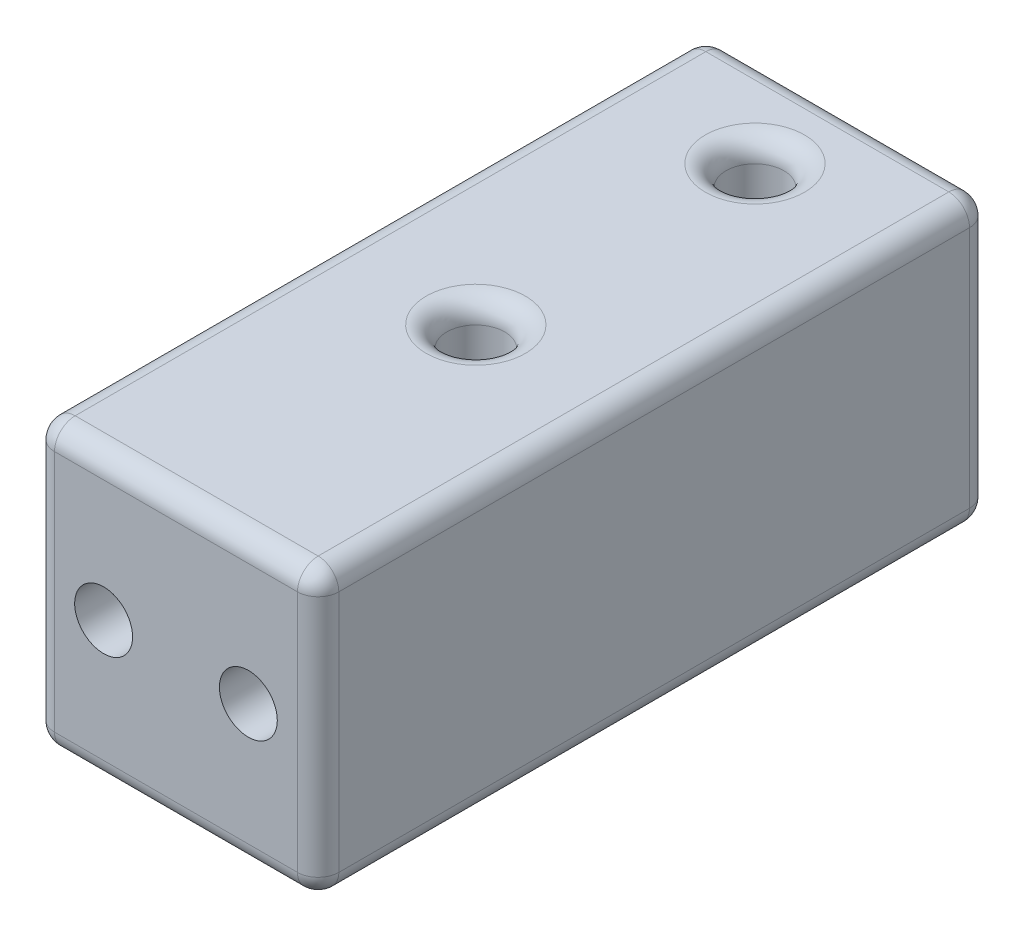
from build123d import *

# Parameters (mm, degrees)
BOSS_EXTRUDE1_DEPTH      = 14.5
BOSS_EXTRUDE1_DEPTH_BACK = 18
SKETCH1_W                = 13.75
SKETCH1_H                = 13.75
CUT_EXTRUDE1_DEPTH       = 21.458036318
CUT_EXTRUDE1_DEPTH_BACK  = 21.458036318
SKETCH2_R                = 1.4
FILLET1_R                = 1
FILLET2_R                = 1
SKETCH3_R                = 1.4
CUT_EXTRUDE2_DEPTH       = 34.923166863


with BuildPart() as part:
    # Sketch1 → Boss-Extrude1 (new, two sides: drawn at the far end of the back side and taken through both)
    with BuildSketch(Plane.XY.offset(-BOSS_EXTRUDE1_DEPTH_BACK)):
        Rectangle(SKETCH1_W, SKETCH1_H)
    extrude(amount=BOSS_EXTRUDE1_DEPTH + BOSS_EXTRUDE1_DEPTH_BACK)

    # Sketch2 → Cut-Extrude1 (cut, two sides: drawn at the far end of the back side and taken through both)
    with BuildSketch(Plane(origin=(0, 0, 0), x_dir=(1, 0, 0), z_dir=(0, 1, 0)).offset(-CUT_EXTRUDE1_DEPTH_BACK)):
        with Locations(Location((0, 0, 0), (0, 0, 270))):
            Circle(SKETCH2_R)
        with Locations(Location((0, 13.5, 0), (0, 0, 270))):
            Circle(SKETCH2_R)
    extrude(amount=CUT_EXTRUDE1_DEPTH + CUT_EXTRUDE1_DEPTH_BACK, mode=Mode.SUBTRACT)

    # Fillet1
    fillet1_edges = [part.edges().sort_by_distance(p)[0] for p in [
        (6.875, 0, 14.5),
        (-6.875, 0, -18),
        (0, 6.875, 14.5),
        (-6.875, 0, 14.5),
        (0, -6.875, 14.5),
        (0, -6.875, -18),
        (6.875, 0, -18),
        (6.875, -6.875, -1.75),
        (-6.875, -6.875, -1.75),
        (-6.875, 6.875, -1.75),
        (6.875, 6.875, -1.75),
        (0, 6.875, -18),
    ]]
    fillet(fillet1_edges, radius=FILLET1_R)

    # Fillet2
    fillet2_edges = [part.edges().sort_by_distance(p)[0] for p in [
        (0, -6.875, -1.4),
        (0, 6.875, -1.4),
        (0, -6.875, -14.9),
        (0, 6.875, -14.9),
    ]]
    fillet(fillet2_edges, radius=FILLET2_R)

    # Sketch3 → Cut-Extrude2 (cut, through all)
    with BuildSketch(Plane.XY.offset(14.5)):
        with Locations((-3.5, 0)):
            Circle(SKETCH3_R)
        with Locations((3.5, 0)):
            Circle(SKETCH3_R)
    extrude(amount=-CUT_EXTRUDE2_DEPTH, mode=Mode.SUBTRACT)


solid = part.part
